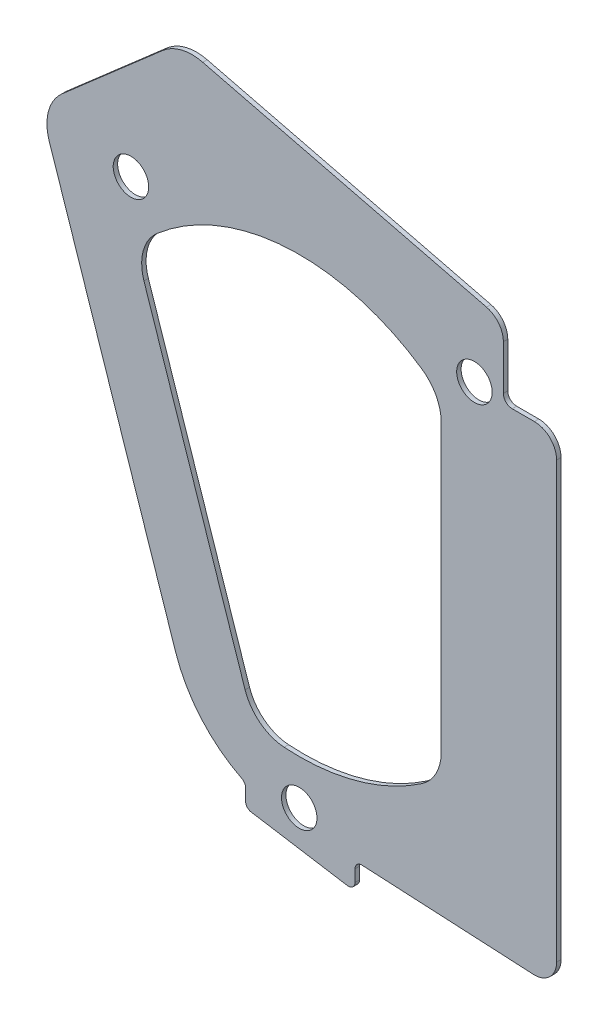
from build123d import *

# Parameters (mm, degrees)
SKETCH1_R         = 4
BUMPER_LINK_DEPTH = 1


with BuildPart() as part:
    # Sketch1 → Bumper link (new body)
    with BuildSketch(Plane.XY):
        with BuildLine():
            Line((-12.098962679, -61.104930733), (-12.098962679, -63.762456748))
            ThreePointArc((-12.098962679, -63.762456748), (-11.741328645, -64.734567853), (-10.838962679, -65.24313227))
            Line((-10.838962679, -65.24313227), (10.838962679, -68.75686773))
            ThreePointArc((10.838962679, -68.75686773), (12.051073784, -68.418558175), (12.578962679, -67.276192209))
            Line((12.578962679, -67.276192209), (12.578962679, -64.618666193))
            ThreePointArc((12.578962679, -64.618666193), (13.046119656, -63.530900001), (14.156609733, -63.12067723))
            Line((14.156609733, -63.12067723), (52.741176488, -65.12067723))
            ThreePointArc((52.741176488, -65.12067723), (56.442810076, -63.753267994), (58, -60.127380685))
            Line((58, -60.127380685), (58, 37.87932277))
            ThreePointArc((58, 37.87932277), (56.535533906, 41.414856676), (53, 42.87932277))
            Line((53, 42.87932277), (48, 42.87932277))
            ThreePointArc((48, 42.87932277), (46.585786438, 43.465109208), (46, 44.87932277))
            Line((46, 44.87932277), (46, 54.964915964))
            ThreePointArc((46, 54.964915964), (44.937003937, 58.047122965), (42.2, 59.818780404))
            Line((42.2, 59.818780404), (-21.754442807, 75.629961849))
            ThreePointArc((-21.754442807, 75.629961849), (-26.508147155, 75.641290323), (-30.729965317, 73.456322411))
            Line((-30.729965317, 73.456322411), (-53.434243128, 53.640724128))
            ThreePointArc((-53.434243128, 53.640724128), (-56.507641468, 48.733101216), (-56.345704543, 42.944809895))
            Line((-56.345704543, 42.944809895), (-27.881366602, -42.461793678))
            ThreePointArc((-27.881366602, -42.461793678), (-22.11635262, -52.595045251), (-12.923793734, -59.765473046))
            ThreePointArc((-12.923793734, -59.765473046), (-12.321709099, -60.318404642), (-12.098962679, -61.104930733))
        make_face()
        with Locations((0, -59)):
            Circle(SKETCH1_R, mode=Mode.SUBTRACT)
        with Locations((-37.924468972, 45.196622144)):
            Circle(SKETCH1_R, mode=Mode.SUBTRACT)
        with Locations((39.478705775, 43.845544703)):
            Circle(SKETCH1_R, mode=Mode.SUBTRACT)
        with BuildLine():
            Line((32, 32.202484376), (32, -32.202484376))
            ThreePointArc((32, -32.202484376), (30.843366339, -36.870982185), (27.641025641, -40.459531652))
            ThreePointArc((27.641025641, -40.459531652), (12.8260046, -47.291580709), (-3.410837238, -48.881143495))
            ThreePointArc((-3.410837238, -48.881143495), (-8.84101253, -46.809125817), (-12.201731931, -42.067224715))
            Line((-12.201731931, -42.067224715), (-34.999206163, 26.336082194))
            ThreePointArc((-34.999206163, 26.336082194), (-35.155216611, 32.146049637), (-32.053817683, 37.061472879))
            ThreePointArc((-32.053817683, 37.061472879), (-2.784759282, 48.920804529), (27.641025641, 40.459531652))
            ThreePointArc((27.641025641, 40.459531652), (30.843366339, 36.870982185), (32, 32.202484376))
        make_face(mode=Mode.SUBTRACT)
    extrude(amount=BUMPER_LINK_DEPTH)


solid = part.part
